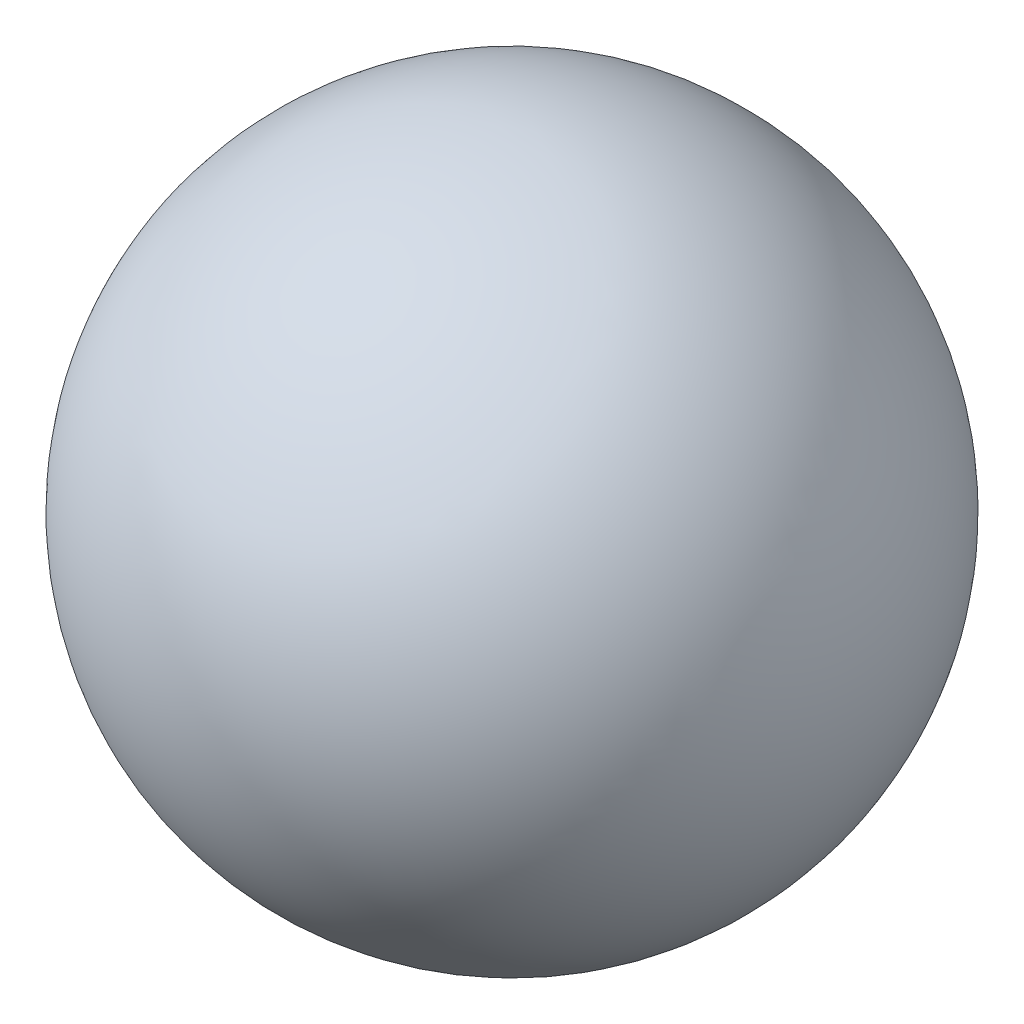
from build123d import *


with BuildPart() as part:
    # Croquis1 → Revolución2 (revolve)
    with BuildSketch(Plane(origin=(0, -2.473851877, 0), x_dir=(1, 0, 0), z_dir=(0, 1, 0))):
        with BuildLine():
            Line((28.180444132, -21.833912487), (-9.819555868, -21.833912487))
            ThreePointArc((-9.819555868, -21.833912487), (9.180444132, -2.833912487), (28.180444132, -21.833912487))
        make_face()
    revolve(axis=Axis((28.180444132, -2.473851877, 21.833912487), (-1, 0, 0)))


solid = part.part
